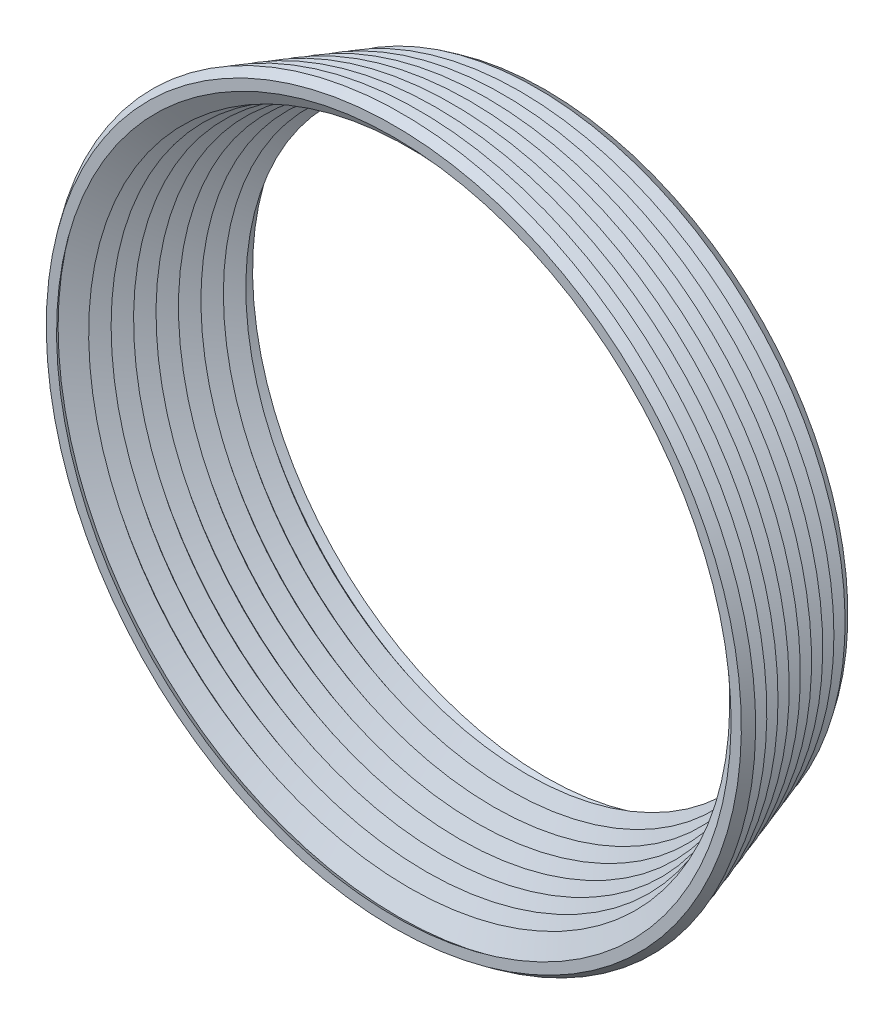
from build123d import *

# Parameters (mm, degrees)
SHELL1_T = -1


with BuildPart() as part:
    # Sketch1 → Revolve1 (revolve)
    with BuildSketch(Plane(origin=(0, 0, 0), x_dir=(0, 0, -1), z_dir=(1, 0, 0)), mode=Mode.PRIVATE) as revolve1_sk:
        Polygon((9, 36), (8, 36.67), (7, 35.33), (6, 37.34), (5, 36), (4, 38.01), (3, 36.67), (2, 38.68), (1, 37.34), (0, 39.35), (-1, 38.01), (-2, 40.02), (-3, 38.68), (-4, 40.69), (-5, 39.35), (-6, 41.36), (-7, 40.02), (-8, 42.03), (-9, 41.33), (-9, 0), (9, 0), align=None)
    revolve(revolve1_sk.sketch.rotate(Axis((0, 0, 9), (0, 0, -1)), 180), axis=Axis((0, 0, 9), (0, 0, -1)))

    # Shell1
    shell1_openings = [part.faces().sort_by_distance(p)[0] for p in [
        (0, 0, -9),
        (0, 0, 9),
    ]]
    offset(amount=SHELL1_T, openings=shell1_openings, kind=Kind.INTERSECTION)


solid = part.part
